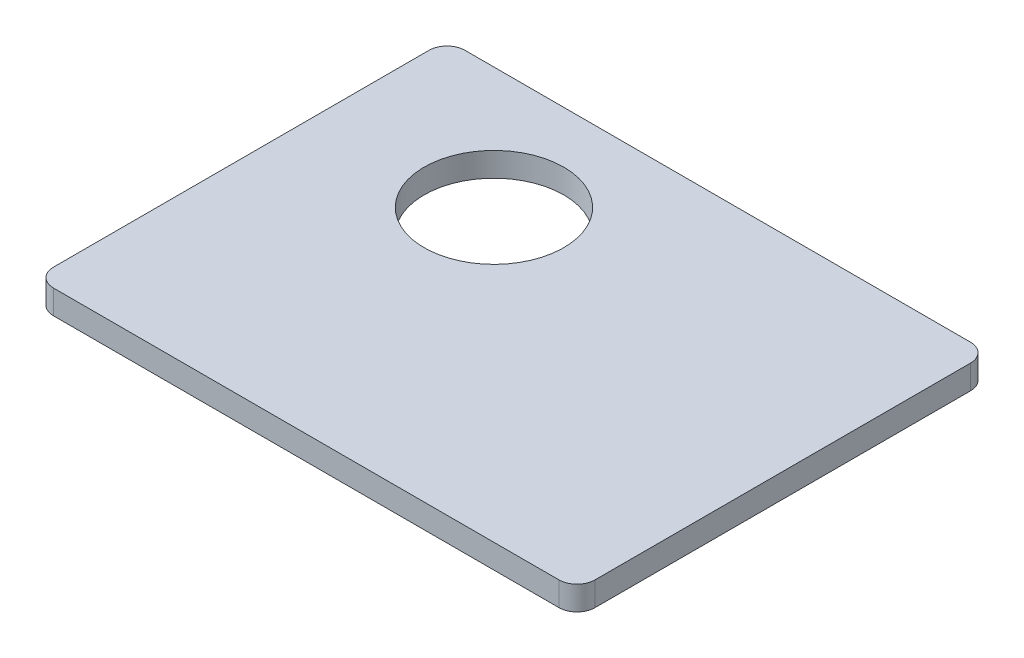
from build123d import *

# Parameters (mm, degrees)
EXTRUDE_1_DEPTH     = 1
SKETCH_2_R          = 2.9
CUT_EXTRUDE_1_DEPTH = 1


with BuildPart() as part:
    # Эскиз1 → Бобышка-Вытянуть1 (new body)
    with BuildSketch(Plane(origin=(0, 0, 0), x_dir=(1, 0, 0), z_dir=(0, 1, 0))):
        with BuildLine():
            Line((-10.759634363, -7.157878984), (10.240365637, -7.157878984))
            ThreePointArc((10.240365637, -7.157878984), (10.770695723, -7.377548898), (10.990365637, -7.907878984))
            Line((10.990365637, -7.907878984), (10.990365637, -23.507878984))
            ThreePointArc((10.990365637, -23.507878984), (10.770695723, -24.03820907), (10.240365637, -24.257878984))
            Line((10.240365637, -24.257878984), (-10.759634363, -24.257878984))
            ThreePointArc((-10.759634363, -24.257878984), (-11.289964449, -24.03820907), (-11.509634363, -23.507878984))
            Line((-11.509634363, -23.507878984), (-11.509634363, -7.907878984))
            ThreePointArc((-11.509634363, -7.907878984), (-11.289964449, -7.377548898), (-10.759634363, -7.157878984))
        make_face()
    extrude(amount=EXTRUDE_1_DEPTH)

    # Эскиз2 → Вырез-Вытянуть1 (cut)
    with BuildSketch(Plane(origin=(0, 1, 0), x_dir=(1, 0, 0), z_dir=(0, 1, 0))):
        with Locations(Location((-4.509634363, -12.207878984, 0), (0, 0, 90))):
            Circle(SKETCH_2_R)
    extrude(amount=-CUT_EXTRUDE_1_DEPTH, mode=Mode.SUBTRACT)


solid = part.part
